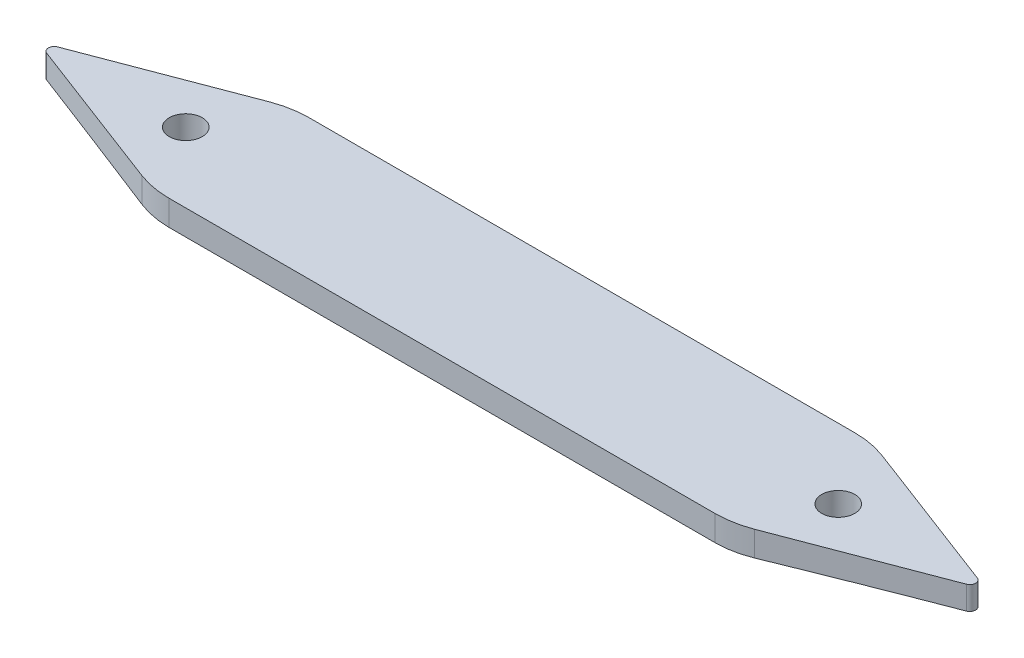
from build123d import *

# Parameters (mm, degrees)
BOSS_EXTRUDE2_DEPTH                               = 22.225
BOSS_EXTRUDE2_DEPTH_BACK                          = 10
SKETCH2_W                                         = 153.14353988
SKETCH2_H                                         = 6.35
CUT_EXTRUDE1_DEPTH                                = 4.7625
SKETCH3_W                                         = 152.758434582
SKETCH3_H                                         = 6.35
CUT_EXTRUDE2_DEPTH                                = 4.7625
FILLET3_R                                         = 12.7
FILLET4_R                                         = 12.7
FILLET5_R                                         = 12.7
FILLET6_R                                         = 12.7
CUT_EXTRUDE3_DEPTH                                = 94.675
CUT_EXTRUDE3_DEPTH_BACK                           = 84.675
SKETCH12_R                                        = 168.402
CSK_FOR_8_FLAT_HEAD_SOCKET_CAP_SCREW2_D           = 4.4958
CSK_FOR_8_FLAT_HEAD_SOCKET_CAP_SCREW2_CSINK_D     = 9.1186
CSK_FOR_8_FLAT_HEAD_SOCKET_CAP_SCREW2_CSINK_ANGLE = 82
SKETCH22_W                                        = 144.636542349
SKETCH22_H                                        = 24.041785527
CUT_EXTRUDE4_DEPTH                                = 42.672


with BuildPart() as part:
    # Sketch1 → Boss-Extrude2 (new, two sides: drawn at the far end of the back side and taken through both)
    with BuildSketch(Plane(origin=(0, 0, 0), x_dir=(1, 0, 0), z_dir=(0, 1, 0)).offset(-BOSS_EXTRUDE2_DEPTH_BACK)):
        with BuildLine():
            Line((37.204956004, 9.525), (-37.204956004, 9.525))
            ThreePointArc((-37.204956004, 9.525), (-39.498289417, 9.316221792), (-41.716221563, 8.696751473))
            Line((-41.716221563, 8.696751473), (-62.649818949, 0.741984467))
            ThreePointArc((-62.649818949, 0.741984467), (-63.161614851, 0), (-62.649818949, -0.741984467))
            Line((-62.649818949, -0.741984467), (-41.716221563, -8.696751473))
            ThreePointArc((-41.716221563, -8.696751473), (-39.498289417, -9.316221792), (-37.204956004, -9.525))
            Line((-37.204956004, -9.525), (37.204956004, -9.525))
            ThreePointArc((37.204956004, -9.525), (39.498289417, -9.316221792), (41.716221563, -8.696751473))
            Line((41.716221563, -8.696751473), (62.649818949, -0.741984467))
            ThreePointArc((62.649818949, -0.741984467), (63.161614851, 0), (62.649818949, 0.741984467))
            Line((62.649818949, 0.741984467), (41.716221563, 8.696751473))
            ThreePointArc((41.716221563, 8.696751473), (39.498289417, 9.316221792), (37.204956004, 9.525))
        make_face()
    extrude(amount=BOSS_EXTRUDE2_DEPTH + BOSS_EXTRUDE2_DEPTH_BACK)

    # Sketch2 → Cut-Extrude1 (cut)
    with BuildSketch(Plane.XY.offset(9.525)):
        with Locations((7.894658594, 12.7)):
            Rectangle(SKETCH2_W, SKETCH2_H)
    extrude(amount=-CUT_EXTRUDE1_DEPTH, mode=Mode.SUBTRACT)

    # Sketch3 → Cut-Extrude2 (cut)
    with BuildSketch(Plane(origin=(0, 0, -9.525), x_dir=(-1, 0, 0), z_dir=(0, 0, -1))):
        with Locations((8.600684972, 12.7)):
            Rectangle(SKETCH3_W, SKETCH3_H)
    extrude(amount=-CUT_EXTRUDE2_DEPTH, mode=Mode.SUBTRACT)

    # Fillet3
    fillet3_edges = [part.edges().sort_by_distance(p)[0] for p in [
        (52.069514915, 12.7, -4.7625),
    ]]
    fillet(fillet3_edges, radius=FILLET3_R)

    # Fillet4
    fillet4_edges = [part.edges().sort_by_distance(p)[0] for p in [
        (52.069514915, 12.7, 4.7625),
    ]]
    fillet(fillet4_edges, radius=FILLET4_R)

    # Fillet5
    fillet5_edges = [part.edges().sort_by_distance(p)[0] for p in [
        (-52.069514915, 12.7, 4.7625),
    ]]
    fillet(fillet5_edges, radius=FILLET5_R)

    # Fillet6
    fillet6_edges = [part.edges().sort_by_distance(p)[0] for p in [
        (-52.069514915, 12.7, -4.7625),
    ]]
    fillet(fillet6_edges, radius=FILLET6_R)

    # Sketch12 → Cut-Extrude3 (cut, two sides: drawn at the far end of the back side and taken through both)
    with BuildSketch(Plane(origin=(0, 0, 0), x_dir=(0, 0, -1), z_dir=(1, 0, 0)).offset(-CUT_EXTRUDE3_DEPTH_BACK)):
        with Locations((0, -168.402)):
            Circle(SKETCH12_R)
    extrude(amount=CUT_EXTRUDE3_DEPTH + CUT_EXTRUDE3_DEPTH_BACK, mode=Mode.SUBTRACT)

    # CSK for #8 Flat Head Socket Cap Screw2 (through all)
    with Locations(Plane(origin=(0, 22.225, 0), x_dir=(1, 0, 0), z_dir=(0, 1, 0))):
        with Locations((-44.45, 0), (44.45, 0)):
            CounterSinkHole(CSK_FOR_8_FLAT_HEAD_SOCKET_CAP_SCREW2_D / 2, CSK_FOR_8_FLAT_HEAD_SOCKET_CAP_SCREW2_CSINK_D / 2, counter_sink_angle=CSK_FOR_8_FLAT_HEAD_SOCKET_CAP_SCREW2_CSINK_ANGLE)

    # Sketch22 → Cut-Extrude4 (cut)
    with BuildSketch(Plane(origin=(0, 3.175, 0), x_dir=(1, 0, 0), z_dir=(0, 1, 0))):
        with Locations((-1.245916594, -0.077514015)):
            Rectangle(SKETCH22_W, SKETCH22_H)
    extrude(amount=CUT_EXTRUDE4_DEPTH, mode=Mode.SUBTRACT)


solid = part.part
